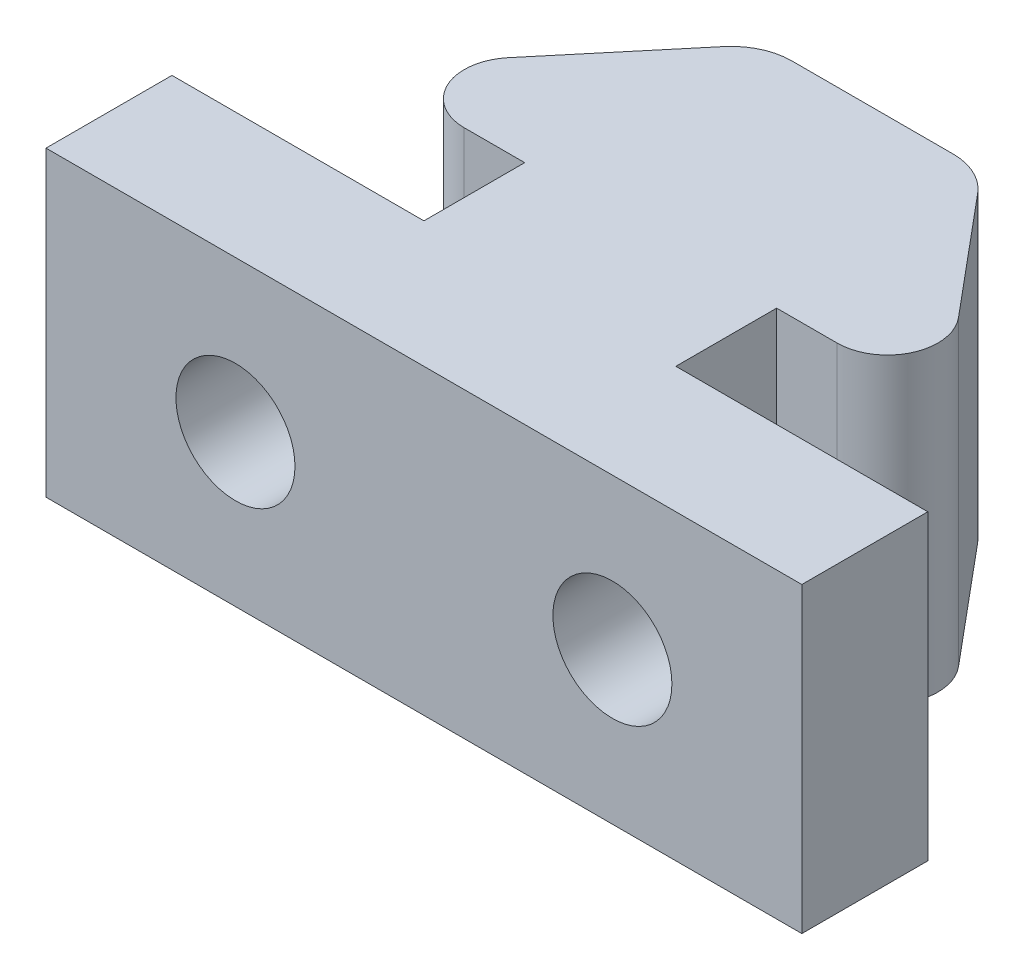
from build123d import *

# Parameters (mm, degrees)
SKETCH1_W           = 19.05
SKETCH1_H           = 7.62
BOSS_EXTRUDE1_DEPTH = 3.175
BOSS_EXTRUDE2_DEPTH = 7.62
SKETCH3_R           = 1.5
CUT_EXTRUDE1_DEPTH  = 3.175


with BuildPart() as part:
    # Sketch1 → Boss-Extrude1 (new body)
    with BuildSketch(Plane.XY):
        Rectangle(SKETCH1_W, SKETCH1_H)
    extrude(amount=BOSS_EXTRUDE1_DEPTH)

    # Sketch2 → Boss-Extrude2 (add)
    with BuildSketch(Plane(origin=(0, 3.81, 0), x_dir=(1, 0, 0), z_dir=(0, 1, 0))):
        with BuildLine():
            Line((3.175, 0), (3.175, 2.54))
            Line((3.175, 2.54), (4.699372999, 2.54))
            ThreePointArc((4.699372999, 2.54), (5.849922417, 3.272286288), (5.673650477, 4.624667659))
            Line((5.673650477, 4.624667659), (3.201132974, 7.581601191))
            ThreePointArc((3.201132974, 7.581601191), (2.677256455, 7.984659302), (2.032, 8.128))
            Line((2.032, 8.128), (-2.032, 8.128))
            ThreePointArc((-2.032, 8.128), (-2.677256455, 7.984659302), (-3.201132974, 7.581601191))
            Line((-3.201132974, 7.581601191), (-5.673650477, 4.624667659))
            ThreePointArc((-5.673650477, 4.624667659), (-5.849922417, 3.272286288), (-4.699372999, 2.54))
            Line((-4.699372999, 2.54), (-3.175, 2.54))
            Line((-3.175, 2.54), (-3.175, 0))
            Line((-3.175, 0), (3.175, 0))
        make_face()
    extrude(amount=-BOSS_EXTRUDE2_DEPTH)

    # Sketch3 → Cut-Extrude1 (cut)
    with BuildSketch(Plane.XY.offset(3.175)):
        with Locations((-4.75, 0)):
            Circle(SKETCH3_R)
        with Locations((4.75, 0)):
            Circle(SKETCH3_R)
    extrude(amount=-CUT_EXTRUDE1_DEPTH, mode=Mode.SUBTRACT)


solid = part.part
